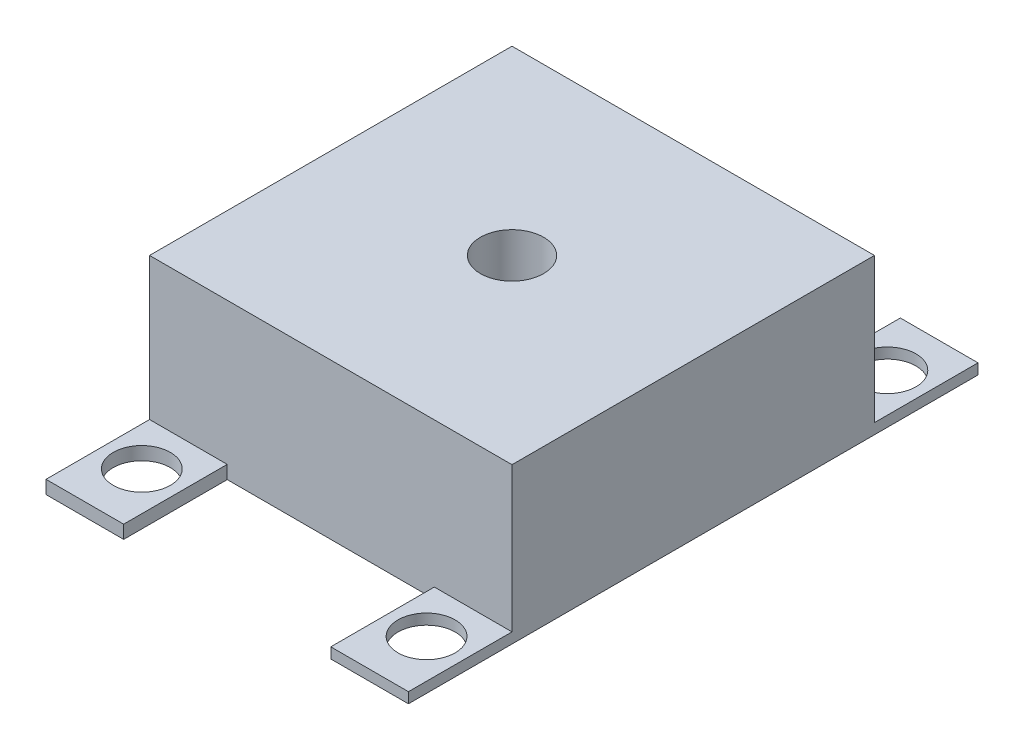
from build123d import *

# Parameters (mm, degrees)
SKETCH2_W                = 35
SKETCH2_H                = 35
BOSS_EXTRUDE1_DEPTH      = 10
SKETCH3_W                = 35
SKETCH3_H                = 35
SKETCH3_W_2              = 30
SKETCH3_H_2              = 30
BOSS_EXTRUDE2_DEPTH      = 15
SKETCH4_W                = 35
SKETCH4_H                = 35
BOSS_EXTRUDE3_DEPTH      = 15
CUT_EXTRUDE1_START       = -40
SKETCH5_R                = 3.05
CUT_EXTRUDE1_DEPTH       = 40
BOSS_EXTRUDE4_DEPTH      = 10
BOSS_EXTRUDE4_DEPTH_BACK = 45
SKETCH6_W                = 7.5
SKETCH6_H                = 1.017843133
SKETCH6_H_2              = 1.2761833
SKETCH7_R                = 2.76
CUT_EXTRUDE2_DEPTH       = 10


with BuildPart() as part:
    # Sketch2 → Boss-Extrude1 (new body)
    with BuildSketch(Plane(origin=(0, 0, 0), x_dir=(1, 0, 0), z_dir=(0, 1, 0))):
        Rectangle(SKETCH2_W, SKETCH2_H)
    extrude(amount=BOSS_EXTRUDE1_DEPTH)


with BuildPart() as body_2:
    # Sketch3 → Boss-Extrude2 (new body)
    with BuildSketch(Plane(origin=(0, 10, 0), x_dir=(1, 0, 0), z_dir=(0, 1, 0))):
        Rectangle(SKETCH3_W, SKETCH3_H)
        Rectangle(SKETCH3_W_2, SKETCH3_H_2, mode=Mode.SUBTRACT)
    extrude(amount=BOSS_EXTRUDE2_DEPTH)


with BuildPart() as body_3:
    # Sketch4 → Boss-Extrude3 (new body)
    with BuildSketch(Plane(origin=(0, 25, 0), x_dir=(1, 0, 0), z_dir=(0, 1, 0))):
        Rectangle(SKETCH4_W, SKETCH4_H)
    extrude(amount=BOSS_EXTRUDE3_DEPTH)


with BuildPart() as cut_extrude1_tool:
    # Sketch5 → Cut-Extrude1 (new body)
    with BuildSketch(Plane(origin=(0, 40, 0), x_dir=(1, 0, 0), z_dir=(0, 1, 0)).offset(CUT_EXTRUDE1_START)):
        with Locations(Location((0, 0, 0), (0, 0, 270))):
            Circle(SKETCH5_R)
    extrude(amount=CUT_EXTRUDE1_DEPTH)


with BuildPart() as part_1:
    add(part.part)

    # Cut-Extrude1: cut by cut_extrude1_tool
    add(cut_extrude1_tool.part, mode=Mode.SUBTRACT)


with BuildPart() as body_3_1:
    add(body_3.part)

    # Cut-Extrude1: cut by cut_extrude1_tool
    add(cut_extrude1_tool.part, mode=Mode.SUBTRACT)

    # Sketch6 → Boss-Extrude4 (add, two sides: drawn at the far end of the back side and taken through both)
    with BuildSketch(Plane(origin=(0, 0, -17.5), x_dir=(-1, 0, 0), z_dir=(0, 0, -1)).offset(-BOSS_EXTRUDE4_DEPTH_BACK)):
        with Locations((-13.75, 25.508921566)):
            Rectangle(SKETCH6_W, SKETCH6_H)
        with Locations((13.75, 25.63809165)):
            Rectangle(SKETCH6_W, SKETCH6_H_2)
    extrude(amount=BOSS_EXTRUDE4_DEPTH + BOSS_EXTRUDE4_DEPTH_BACK)

    # Sketch7 → Cut-Extrude2 (cut)
    with BuildSketch(Plane(origin=(0, 26.2761833, 0), x_dir=(1, 0, 0), z_dir=(0, 1, 0))):
        with Locations(Location((-13.75, 22.5, 0), (0, 0, 270))):
            Circle(SKETCH7_R)
        with Locations(Location((13.75, 22.5, 0), (0, 0, 270))):
            Circle(SKETCH7_R)
        with Locations(Location((13.75, -22, 0), (0, 0, 270))):
            Circle(SKETCH7_R)
        with Locations(Location((-13.75, -22, 0), (0, 0, 270))):
            Circle(SKETCH7_R)
    extrude(amount=-CUT_EXTRUDE2_DEPTH, mode=Mode.SUBTRACT)


solid = body_3_1.part
